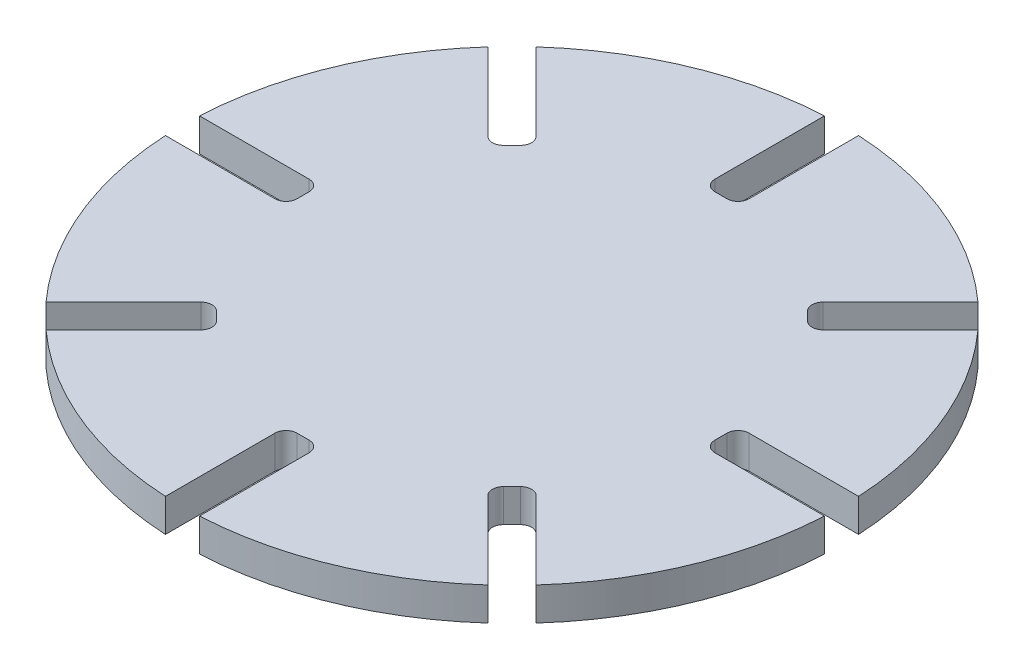
from build123d import *

# Parameters (mm, degrees)
SKETCH_2_R          = 60
EXTRUDE_1_DEPTH     = 6
SKETCH_3_W          = 60
SKETCH_3_H          = 6.2
SKETCH_3_W_2        = 6.2
SKETCH_3_H_2        = 60
CUT_EXTRUDE_1_DEPTH = 6
FILLET_1_R          = 2


with BuildPart() as part:
    # 草图2 → 凸台-拉伸1 (new body)
    with BuildSketch(Plane(origin=(0, 0, 0), x_dir=(1, 0, 0), z_dir=(0, 1, 0))):
        with Locations(Location((0, 0, 0), (0, 0, 270))):
            Circle(SKETCH_2_R)
    extrude(amount=EXTRUDE_1_DEPTH)

    # 草图3 → 切除-拉伸1 (cut)
    with BuildSketch(Plane(origin=(0, 6, 0), x_dir=(1, 0, 0), z_dir=(0, 1, 0))):
        with Locations((68, 0)):
            Rectangle(SKETCH_3_W, SKETCH_3_H)
        Polygon((24.678026663, -29.062088707), (67.104433535, -71.488495578), (71.488495578, -67.104433535), (29.062088707, -24.678026663), align=None)
        with Locations((0, -68)):
            Rectangle(SKETCH_3_W_2, SKETCH_3_H_2)
        Polygon((-29.062088707, -24.678026663), (-71.488495578, -67.104433535), (-67.104433535, -71.488495578), (-24.678026663, -29.062088707), align=None)
        with Locations((-68, 0)):
            Rectangle(SKETCH_3_W, SKETCH_3_H)
        Polygon((-24.678026663, 29.062088707), (-67.104433535, 71.488495578), (-71.488495578, 67.104433535), (-29.062088707, 24.678026663), align=None)
        with Locations((0, 68)):
            Rectangle(SKETCH_3_W_2, SKETCH_3_H_2)
        Polygon((29.062088707, 24.678026663), (71.488495578, 67.104433535), (67.104433535, 71.488495578), (24.678026663, 29.062088707), align=None)
    extrude(amount=-CUT_EXTRUDE_1_DEPTH, mode=Mode.SUBTRACT)

    # 圆角1
    fillet_1_edges = [part.edges().sort_by_distance(p)[0] for p in [
        (29.062088707, 3, 24.678026663),
        (24.678026663, 3, 29.062088707),
        (38, 3, -3.1),
        (38, 3, 3.1),
        (24.678026663, 3, -29.062088707),
        (29.062088707, 3, -24.678026663),
        (-3.1, 3, -38),
        (3.1, 3, -38),
        (-29.062088707, 3, -24.678026663),
        (-24.678026663, 3, -29.062088707),
        (-38, 3, 3.1),
        (-38, 3, -3.1),
        (-24.678026663, 3, 29.062088707),
        (-29.062088707, 3, 24.678026663),
        (3.1, 3, 38),
        (-3.1, 3, 38),
    ]]
    fillet(fillet_1_edges, radius=FILLET_1_R)


solid = part.part
